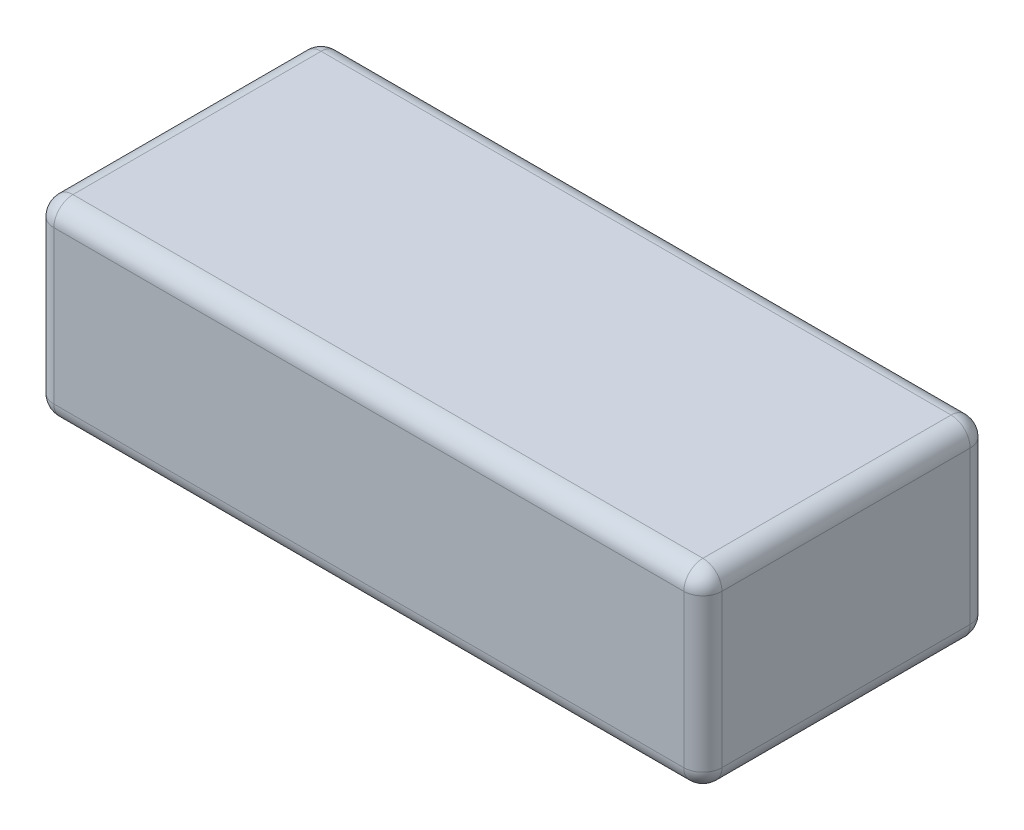
from build123d import *

# Parameters (mm, degrees)
SKETCH1_W           = 70
SKETCH1_H           = 30
BOSS_EXTRUDE1_DEPTH = 20
FILLET1_R           = 2


with BuildPart() as part:
    # Sketch1 → Boss-Extrude1 (new body)
    with BuildSketch(Plane(origin=(0, 0, 0), x_dir=(1, 0, 0), z_dir=(0, 1, 0))):
        Rectangle(SKETCH1_W, SKETCH1_H)
    extrude(amount=BOSS_EXTRUDE1_DEPTH)

    # Fillet1
    fillet1_edges = [part.edges().sort_by_distance(p)[0] for p in [
        (-35, 20, 0),
        (0, 20, 15),
        (35, 20, 0),
        (0, 0, 15),
        (-35, 0, 0),
        (0, 0, -15),
        (35, 0, 0),
        (35, 10, 15),
        (-35, 10, 15),
        (-35, 10, -15),
        (35, 10, -15),
        (0, 20, -15),
    ]]
    fillet(fillet1_edges, radius=FILLET1_R)


solid = part.part
